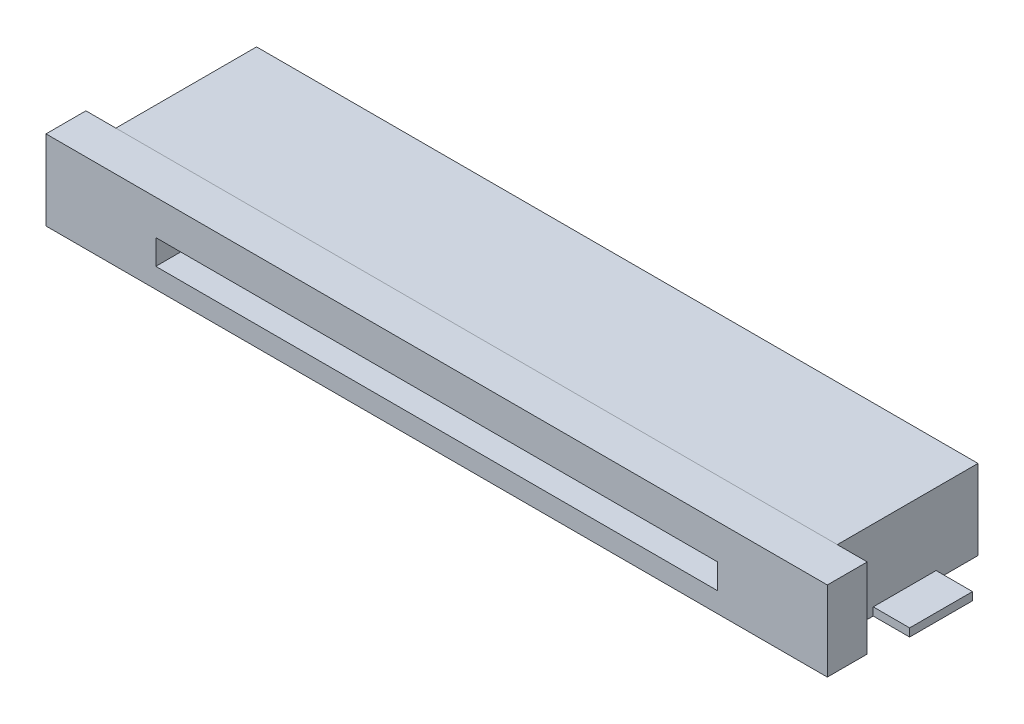
from build123d import *

# Parameters (mm, degrees)
SKETCH1_W          = 19.8882
SKETCH1_H          = 2.032
EXTRUDE1_DEPTH     = 1.016
SKETCH2_W          = 18.3642
SKETCH2_H          = 2.032
EXTRUDE2_DEPTH     = 3.5814
SKETCH6_W          = 14.3002
SKETCH6_H          = 0.635
CUT_EXTRUDE1_DEPTH = 3.302
SKETCH7_W          = 0.254
SKETCH7_H          = 0.762
EXTRUDE3_DEPTH     = 0.2032
LPATTERN1_COUNT    = 15
LPATTERN1_PITCH    = 0.508
LPATTERN2_COUNT    = 14
LPATTERN2_PITCH    = 0.508
SKETCH8_W          = 0.2032
SKETCH8_H          = 0.5588
EXTRUDE4_DEPTH     = 0.254
LPATTERN3_COUNT    = 28
LPATTERN3_PITCH    = 0.508
CHAMFER1_SIZE      = 0.127
SKETCH9_W          = 2.1082
SKETCH9_H          = 1.6002
EXTRUDE5_DEPTH     = 0.2032


with BuildPart() as part:
    # Sketch1 → Extrude1 (new body)
    with BuildSketch(Plane.XY):
        with Locations((0, 1.016)):
            Rectangle(SKETCH1_W, SKETCH1_H)
    extrude(amount=EXTRUDE1_DEPTH)

    # Sketch2 → Extrude2 (add)
    with BuildSketch(Plane(origin=(0, 0, 0), x_dir=(-1, 0, 0), z_dir=(0, 0, -1))):
        with Locations((0, 1.016)):
            Rectangle(SKETCH2_W, SKETCH2_H)
    extrude(amount=EXTRUDE2_DEPTH)

    # Sketch6 → Cut-Extrude1 (cut)
    with BuildSketch(Plane.XY.offset(1.016)):
        with Locations((0, 0.8255)):
            Rectangle(SKETCH6_W, SKETCH6_H)
    extrude(amount=-CUT_EXTRUDE1_DEPTH, mode=Mode.SUBTRACT)

    # Sketch7 → Extrude3 (add)
    with BuildSketch(Plane.XZ):
        with Locations((-0.254, -3.9116)):
            Rectangle(SKETCH7_W, SKETCH7_H)
    extrude3 = extrude(amount=-EXTRUDE3_DEPTH)

    # LPattern1: Extrude3 ×15
    with Locations(*[(i * LPATTERN1_PITCH, 0, 0) for i in range(1, LPATTERN1_COUNT)]):
        add(extrude3)

    # LPattern2: Extrude3 ×14
    with Locations(*[(-i * LPATTERN2_PITCH, 0, 0) for i in range(1, LPATTERN2_COUNT)]):
        add(extrude3)

    # Sketch8 → Extrude4 (add)
    with BuildSketch(Plane(origin=(6.985, 0, 0), x_dir=(0, 0, -1), z_dir=(1, 0, 0))):
        with Locations((3.683, 0.4826)):
            Rectangle(SKETCH8_W, SKETCH8_H)
    extrude4 = extrude(amount=-EXTRUDE4_DEPTH)

    # LPattern3: Extrude4 ×28
    with Locations(*[(-i * LPATTERN3_PITCH, 0, 0) for i in range(1, LPATTERN3_COUNT)]):
        add(extrude4)

    # Chamfer1
    chamfer1_edges = [part.edges().sort_by_distance(p)[0] for p in [
        (6.858, 0.762, -3.7846),
        (6.35, 0.762, -3.7846),
        (5.842, 0.762, -3.7846),
        (5.334, 0.762, -3.7846),
        (4.826, 0.762, -3.7846),
        (4.318, 0.762, -3.7846),
        (3.81, 0.762, -3.7846),
        (3.302, 0.762, -3.7846),
        (2.794, 0.762, -3.7846),
        (2.286, 0.762, -3.7846),
        (1.778, 0.762, -3.7846),
        (1.27, 0.762, -3.7846),
        (0.762, 0.762, -3.7846),
        (0.254, 0.762, -3.7846),
        (-0.254, 0.762, -3.7846),
        (-0.762, 0.762, -3.7846),
        (-1.27, 0.762, -3.7846),
        (-1.778, 0.762, -3.7846),
        (-2.286, 0.762, -3.7846),
        (-2.794, 0.762, -3.7846),
        (-3.302, 0.762, -3.7846),
        (-3.81, 0.762, -3.7846),
        (-4.318, 0.762, -3.7846),
        (-4.826, 0.762, -3.7846),
        (-5.334, 0.762, -3.7846),
        (-5.842, 0.762, -3.7846),
        (-6.35, 0.762, -3.7846),
        (-6.858, 0.762, -3.7846),
    ]]
    chamfer(chamfer1_edges, length=CHAMFER1_SIZE)

    # Sketch9 → Extrude5 (add)
    with BuildSketch(Plane.XZ):
        with Locations((-9.0551, -1.7145)):
            Rectangle(SKETCH9_W, SKETCH9_H)
        with Locations((9.0551, -1.7145)):
            Rectangle(SKETCH9_W, SKETCH9_H)
    extrude(amount=-EXTRUDE5_DEPTH)


solid = part.part
